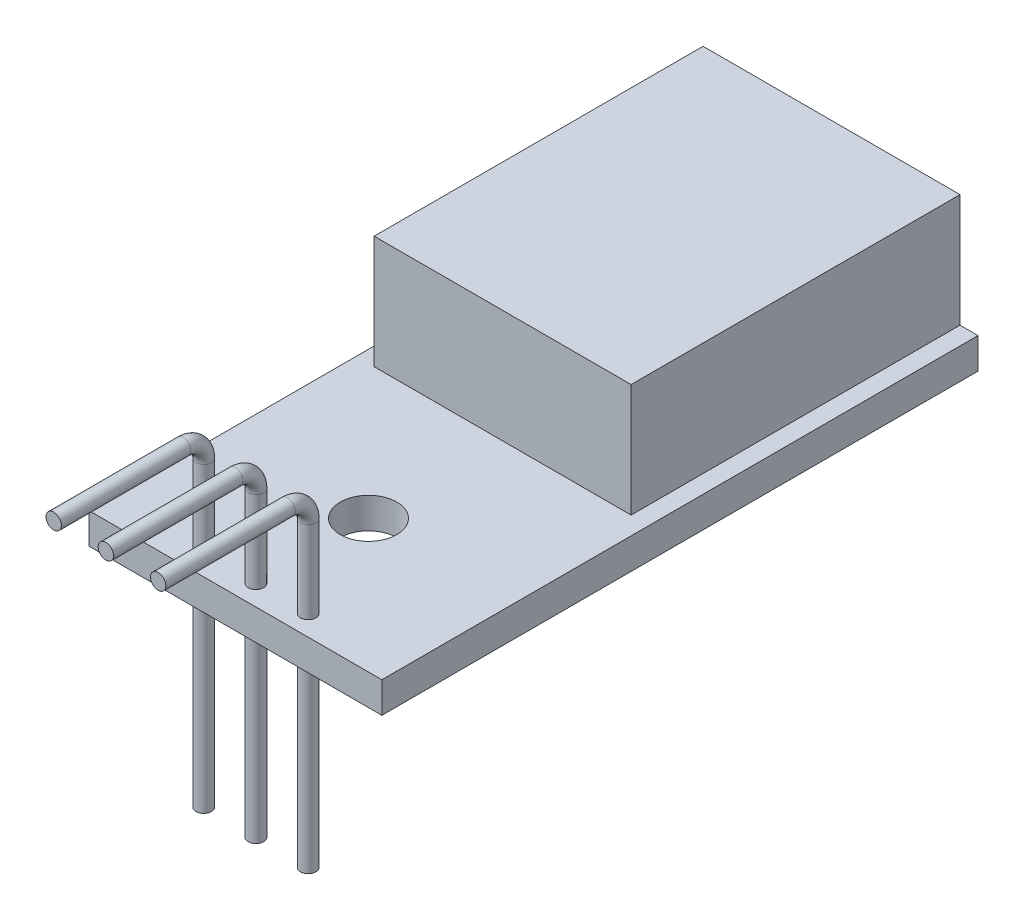
from build123d import *

# Parameters (mm, degrees)
SKETCH1_W           = 14.25
SKETCH1_H           = 29
SKETCH1_R           = 1.375
BOSS_EXTRUDE1_DEPTH = 1.5
SKETCH2_W           = 12.5
SKETCH2_H           = 16
BOSS_EXTRUDE2_DEPTH = 5.5
SKETCH4_R           = 0.375
LPATTERN1_COUNT     = 2
LPATTERN1_PITCH     = 2.54
LPATTERN1_COL_COUNT = 2
LPATTERN1_COL_PITCH = 2.54
MOVE_FACE1_BY       = 8.2
MOVE_FACE1_2_BY     = 8.2
MOVE_FACE1_3_BY     = 8.2


with BuildPart() as part:
    # Sketch1 → Boss-Extrude1 (new body)
    with BuildSketch(Plane(origin=(0, 0, 0), x_dir=(1, 0, 0), z_dir=(0, 1, 0))):
        Rectangle(SKETCH1_W, SKETCH1_H)
        with Locations(Location((0, -8.025, 0), (0, 0, 270))):
            Circle(SKETCH1_R, mode=Mode.SUBTRACT)
    extrude(amount=BOSS_EXTRUDE1_DEPTH)

    # Sketch2 → Boss-Extrude2 (add)
    with BuildSketch(Plane(origin=(0, 1.5, 0), x_dir=(1, 0, 0), z_dir=(0, 1, 0))):
        with Locations((0, 6.5)):
            Rectangle(SKETCH2_W, SKETCH2_H)
    extrude(amount=BOSS_EXTRUDE2_DEPTH)

    # Sweep1: sweep along a path in Sketch3
    with BuildLine(Plane.ZY) as sweep1_path:
        Line((13.5, -1), (13.5, 5.5))
        ThreePointArc((13.5, 5.5), (13.792893219, 6.207106781), (14.5, 6.5))
        Line((14.5, 6.5), (20.8, 6.5))
    # Sketch4 → Sweep1 (sweep)
    with BuildSketch(Plane(origin=(0, -1, 0), x_dir=(-1, 0, 0), z_dir=(0, -1, 0))):
        with Locations((0, -13.5)):
            Circle(SKETCH4_R)
    sweep1 = sweep(path=sweep1_path.line)

    # LPattern1: Sweep1 ×2
    with Locations(*[(-i * LPATTERN1_PITCH, 0, 0) for i in range(1, LPATTERN1_COUNT)]):
        add(sweep1)

    # LPattern1 col: Sweep1 ×2
    with Locations(*[(i * LPATTERN1_COL_PITCH, 0, 0) for i in range(1, LPATTERN1_COL_COUNT)]):
        add(sweep1)

    # Move Face1: a face moved outward by 8.2
    extrude(part.faces().sort_by_distance((2.54, -1, 13.5))[0], amount=MOVE_FACE1_BY, dir=(0, -1, 0))

    # Move Face1 2: a face moved outward by 8.2
    extrude(part.faces().sort_by_distance((0, -1, 13.5))[0], amount=MOVE_FACE1_2_BY, dir=(0, -1, 0))

    # Move Face1 3: a face moved outward by 8.2
    extrude(part.faces().sort_by_distance((-2.54, -1, 13.5))[0], amount=MOVE_FACE1_3_BY, dir=(0, -1, 0))


solid = part.part
